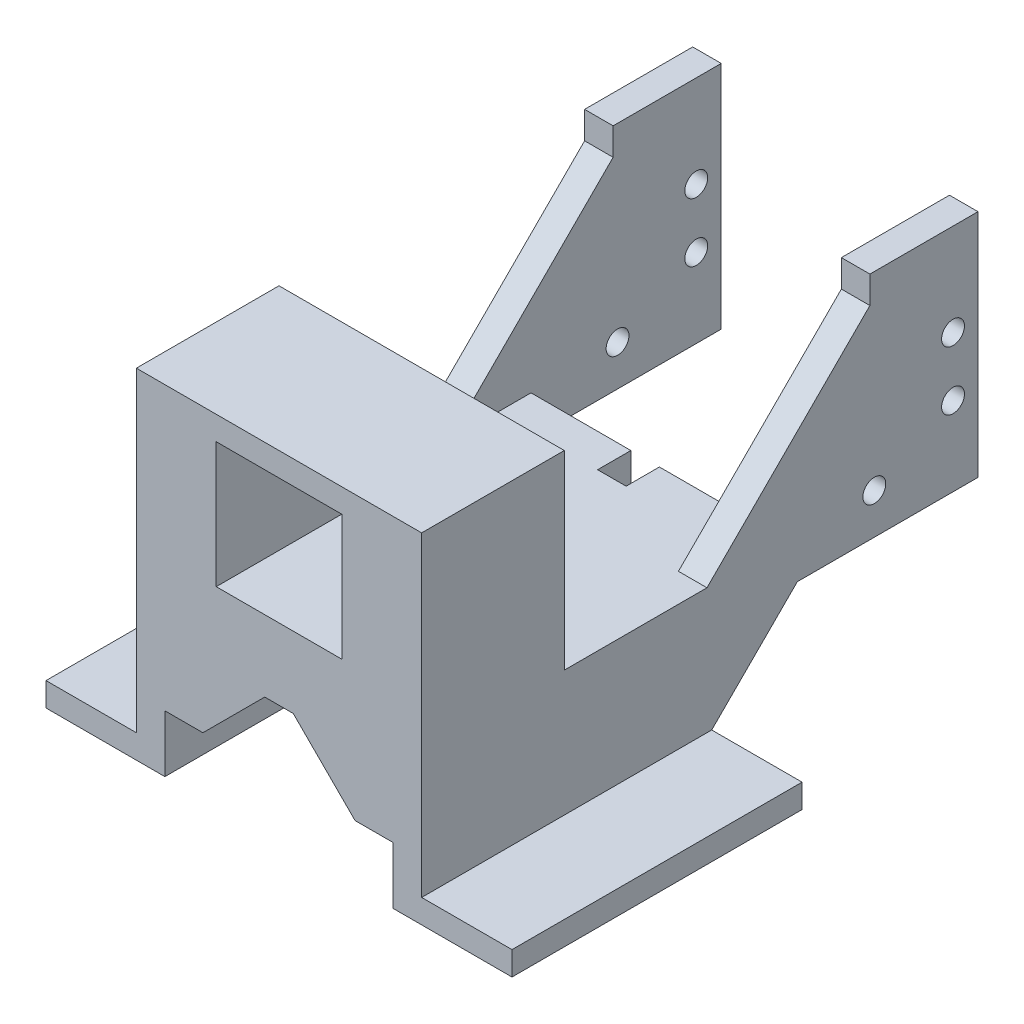
from build123d import *

# Parameters (mm, degrees)
SKETCH1_W            = 26.4
SKETCH1_H            = 26.4
BOSS_EXTRUDE1_DEPTH  = 117
SKETCH60_W           = 48
SKETCH60_H           = 40
CUT_EXTRUDE1_DEPTH   = 87
CUT_EXTRUDE2_DEPTH   = 157.009486891
M4_CLEARANCE_HOLE1_D = 4.8
SKETCH66_W           = 48
SKETCH66_H           = 31.290838495
CUT_EXTRUDE3_DEPTH   = 40
CUT_EXTRUDE5_DEPTH   = 157.009486891
SKETCH69_W           = 98
SKETCH69_H           = 56
CUT_EXTRUDE6_DEPTH   = 144.174578749
SKETCH70_W           = 6
SKETCH70_H           = 7
CUT_EXTRUDE7_DEPTH   = 136.066502139


with BuildPart() as part:
    # Sketch1 → Boss-Extrude1 (new body)
    with BuildSketch(Plane.XY):
        Polygon((-3, -41.4), (3, -41.4), (16, -54.4), (24, -54.4), (24, -66.4), (49, -66.4), (49, -61.4), (30, -61.4), (30, 5), (-30, 5), (-30, -61.4), (-49, -61.4), (-49, -66.4), (-24, -66.4), (-24, -54.4), (-16, -54.4), align=None)
        with Locations((0, -13.2)):
            Rectangle(SKETCH1_W, SKETCH1_H, mode=Mode.SUBTRACT)
    extrude(amount=BOSS_EXTRUDE1_DEPTH)

    # Sketch60 → Cut-Extrude1 (cut)
    with BuildSketch(Plane(origin=(0, 0, 0), x_dir=(-1, 0, 0), z_dir=(0, 0, -1))):
        with Locations((0, -15)):
            Rectangle(SKETCH60_W, SKETCH60_H)
    extrude(amount=-CUT_EXTRUDE1_DEPTH, mode=Mode.SUBTRACT)

    # Sketch61 → Cut-Extrude2 (cut, through all)
    with BuildSketch(Plane.ZY.offset(30)):
        Polygon((0, -43.4), (38, -43.4), (56, -61.4), (0, -61.4), align=None)
    extrude(amount=-CUT_EXTRUDE2_DEPTH, mode=Mode.SUBTRACT)

    # M4 Clearance Hole1 (through all)
    with Locations(Plane.ZY.offset(30)):
        with Locations((5.25, -14.37), (5.25, -26.77), (21.8, -34.86)):
            Hole(M4_CLEARANCE_HOLE1_D / 2)

    # Sketch66 → Cut-Extrude3 (cut)
    with BuildSketch(Plane(origin=(0, 0, 0), x_dir=(-1, 0, 0), z_dir=(0, 0, -1))):
        with Locations((0, -50.645419248)):
            Rectangle(SKETCH66_W, SKETCH66_H)
    extrude(amount=-CUT_EXTRUDE3_DEPTH, mode=Mode.SUBTRACT)

    # Sketch68 → Cut-Extrude5 (cut, through all)
    with BuildSketch(Plane.ZY.offset(30)):
        Polygon((22.733334145, -0.733334145), (57, -35), (87, -35), (87, 5), (22.733334145, 5), align=None)
    extrude(amount=-CUT_EXTRUDE5_DEPTH, mode=Mode.SUBTRACT)

    # Sketch69 → Cut-Extrude6 (cut, through all)
    with BuildSketch(Plane(origin=(0, -61.4, 0), x_dir=(1, 0, 0), z_dir=(0, 1, 0))):
        with Locations((0, -28)):
            Rectangle(SKETCH69_W, SKETCH69_H)
    extrude(amount=-CUT_EXTRUDE6_DEPTH, mode=Mode.SUBTRACT)

    # Sketch70 → Cut-Extrude7 (cut, through all)
    with BuildSketch(Plane.XZ.offset(41.4)):
        with Locations((0, 43.5)):
            Rectangle(SKETCH70_W, SKETCH70_H)
    extrude(amount=-CUT_EXTRUDE7_DEPTH, mode=Mode.SUBTRACT)


solid = part.part
